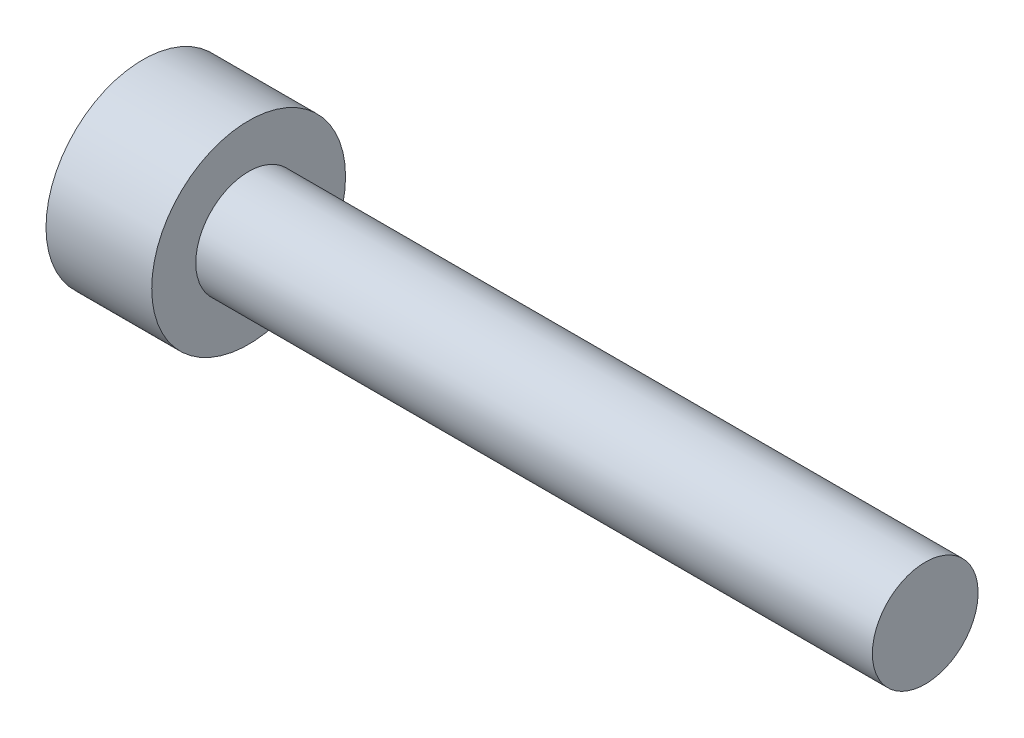
from build123d import *


with BuildPart() as part:
    # Axial profile (mm) → Full revolution (revolve)
    with BuildSketch(Plane.XY, mode=Mode.PRIVATE) as full_revolution_sk:
        Polygon((131.5, 0), (153.7, 0), (153.7, 1.5), (134.5, 1.5), (134.5, 2.75), (131.5, 2.75), align=None)
    revolve(full_revolution_sk.sketch.rotate(Axis((-110, 0, 0), (1, 0, 0)), 90), axis=Axis((-110, 0, 0), (1, 0, 0)))


solid = part.part
